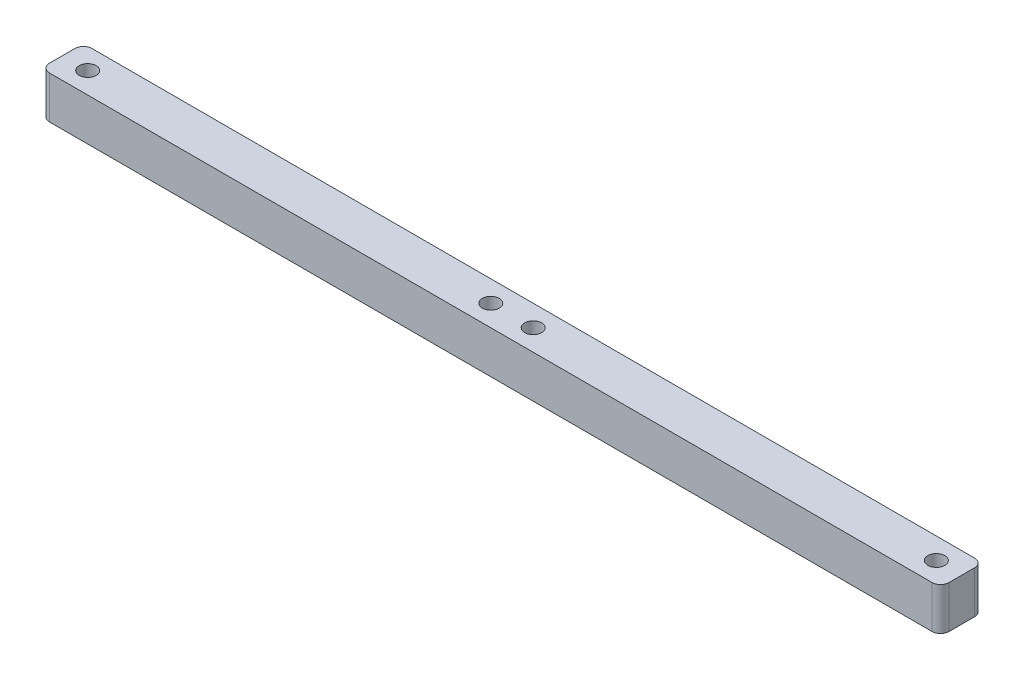
from build123d import *

# Parameters (mm, degrees)
SKETCH1_W           = 106
SKETCH1_H           = 5
BOSS_EXTRUDE1_DEPTH = 5
FILLET1_R           = 1
FILLET2_R           = 1
SKETCH2_R           = 1
CUT_EXTRUDE1_DEPTH  = 54.293995909


with BuildPart() as part:
    # Sketch1 → Boss-Extrude1 (new body)
    with BuildSketch(Plane(origin=(0, 0, 0), x_dir=(1, 0, 0), z_dir=(0, 1, 0))):
        Rectangle(SKETCH1_W, SKETCH1_H)
    extrude(amount=BOSS_EXTRUDE1_DEPTH)

    # Fillet1
    fillet1_edges = [part.edges().sort_by_distance(p)[0] for p in [
        (-53, 2.5, 2.5),
        (-53, 2.5, -2.5),
    ]]
    fillet(fillet1_edges, radius=FILLET1_R)

    # Fillet2
    fillet2_edges = [part.edges().sort_by_distance(p)[0] for p in [
        (53, 2.5, 2.5),
        (53, 2.5, -2.5),
    ]]
    fillet(fillet2_edges, radius=FILLET2_R)

    # Sketch2 → Cut-Extrude1 (cut, through all)
    with BuildSketch(Plane(origin=(0, 5, 0), x_dir=(1, 0, 0), z_dir=(0, 1, 0))):
        with Locations(Location((-50, 0, 0), (0, 0, 270))):
            Circle(SKETCH2_R)
        with Locations(Location((50, 0, 0), (0, 0, 270))):
            Circle(SKETCH2_R)
        with Locations(Location((-2.5, 0, 0), (0, 0, 270))):
            Circle(SKETCH2_R)
        with Locations(Location((2.5, 0, 0), (0, 0, 270))):
            Circle(SKETCH2_R)
    extrude(amount=-CUT_EXTRUDE1_DEPTH, mode=Mode.SUBTRACT)


solid = part.part
